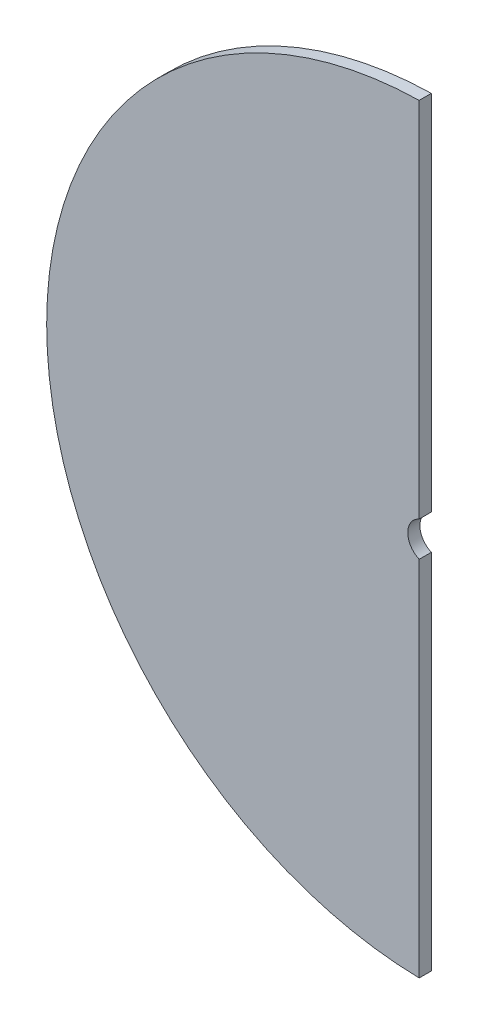
from build123d import *

# Parameters (mm, degrees)
AUFSATZ_LINEAR_AUSTRAGEN1_DEPTH = 1.6
SCHNITT_LINEAR_AUSTRAGEN1_DEPTH = 71.728777736


with BuildPart() as part:
    # Skizze1 → Aufsatz-Linear austragen1 (new body)
    with BuildSketch(Plane.XY):
        with BuildLine():
            Line((0, 50), (0, 2.5))
            ThreePointArc((0, 2.5), (-2.5, 0), (0, -2.5))
            Line((0, -2.5), (0, -50))
            ThreePointArc((0, -50), (-50, 0), (0, 50))
        make_face()
    extrude(amount=AUFSATZ_LINEAR_AUSTRAGEN1_DEPTH)

    # Skizze2 → Schnitt-Linear austragen1 (cut, through all)
    with BuildSketch(Plane.XY.offset(1.6)):
        Polygon((-1, 49.989999), (-1, -49.989999), (10.868946085, -55.966475583), (12.925250404, 54.301848277), align=None)
    extrude(amount=-SCHNITT_LINEAR_AUSTRAGEN1_DEPTH, mode=Mode.SUBTRACT)


solid = part.part
